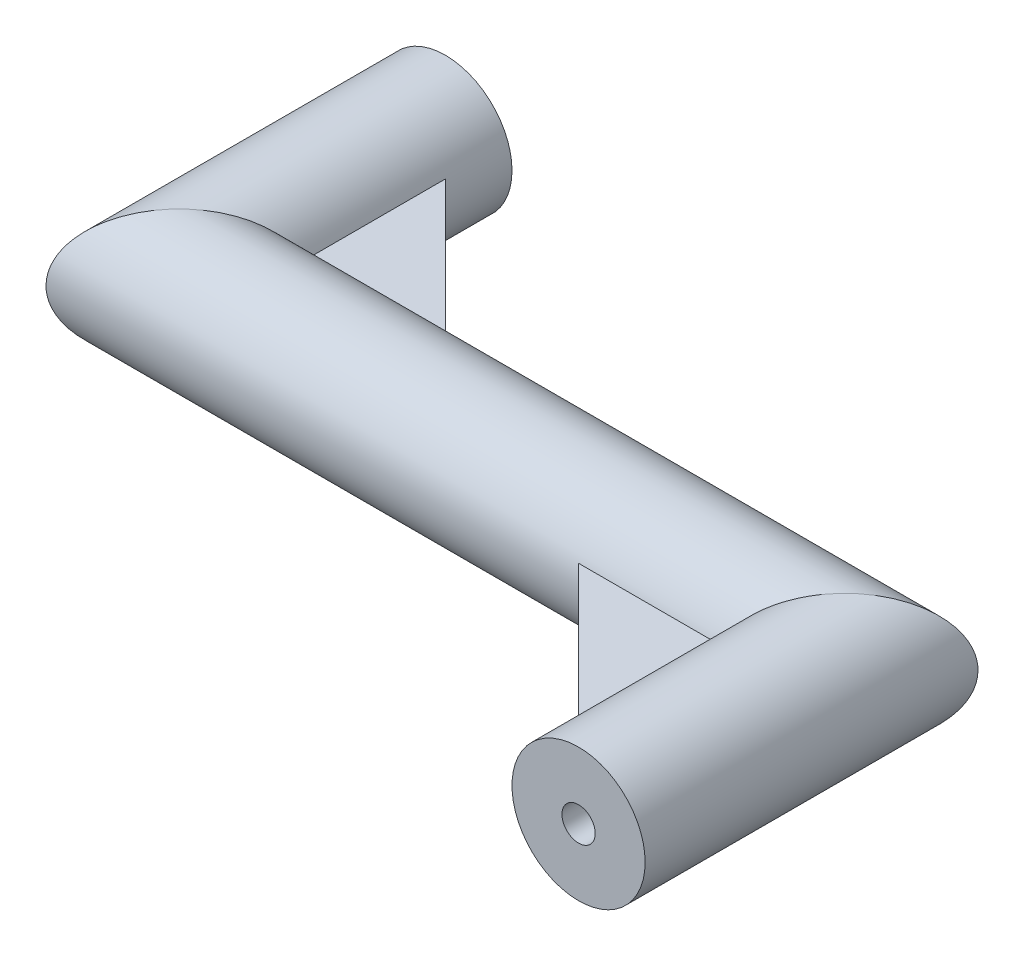
from build123d import *

# Parameters (mm, degrees)
SKETCH1_R           = 3
BOSS_EXTRUDE1_DEPTH = 1
SKETCH5_R           = 0.75
CUT_EXTRUDE1_DEPTH  = 10
SKETCH6_R           = 0.75
CUT_EXTRUDE2_DEPTH  = 10


with BuildPart() as part:
    # Sweep1: sweep along a path in Sketch3
    with BuildLine(Plane(origin=(0, 0, 0), x_dir=(1, 0, 0), z_dir=(0, 1, 0))) as sweep1_path:
        Line((0, 0), (0, 12))
        Line((0, 12), (-30, 12))
        Line((-30, 12), (-30, 24))
    # Sketch1 → Sweep1 (sweep)
    with BuildSketch(Plane.XY):
        Circle(SKETCH1_R)
    sweep(path=sweep1_path.line, transition=Transition.RIGHT)

    # Sketch4 → Boss-Extrude1 (add, symmetric)
    with BuildSketch(Plane(origin=(0, 0, 0), x_dir=(1, 0, 0), z_dir=(0, 1, 0))):
        Polygon((-30, 12), (-18, 12), (-30, 24), align=None)
        Polygon((-12, 12), (0, 0), (0, 12), align=None)
    extrude(amount=BOSS_EXTRUDE1_DEPTH, both=True)

    # Sketch5 → Cut-Extrude1 (cut)
    with BuildSketch(Plane.XY):
        Circle(SKETCH5_R)
    extrude(amount=-CUT_EXTRUDE1_DEPTH, mode=Mode.SUBTRACT)

    # Sketch6 → Cut-Extrude2 (cut)
    with BuildSketch(Plane(origin=(0, 0, -24), x_dir=(-1, 0, 0), z_dir=(0, 0, -1))):
        with Locations((30, 0)):
            Circle(SKETCH6_R)
    extrude(amount=-CUT_EXTRUDE2_DEPTH, mode=Mode.SUBTRACT)


solid = part.part
